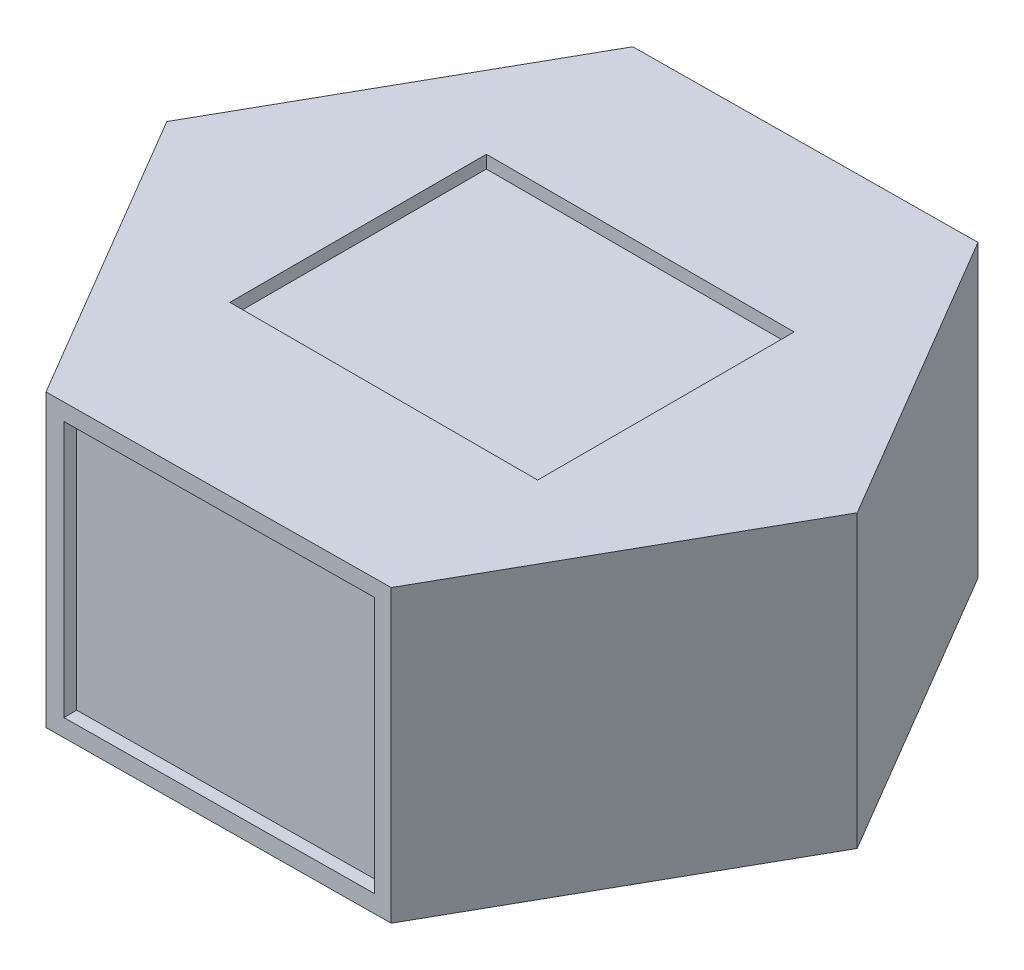
from build123d import *

# Parameters (mm, degrees)
BOSS_EXTRUDE1_DEPTH = 34
SKETCH2_W           = 36
SKETCH2_H           = 30
CUT_EXTRUDE1_DEPTH  = 1.5
SKETCH3_W           = 36
SKETCH3_H           = 30
CUT_EXTRUDE2_DEPTH  = 1.5
SKETCH4_W           = 36
SKETCH4_H           = 30
CUT_EXTRUDE3_DEPTH  = 1.5
CUT_EXTRUDE5_DEPTH  = 31.5
SKETCH6_W           = 37.25
SKETCH6_H           = 1.921966438
BOSS_EXTRUDE2_DEPTH = 5
SKETCH7_W           = 37.25
SKETCH7_H           = 2.5
BOSS_EXTRUDE3_DEPTH = 5


with BuildPart() as part:
    # Sketch1 → Boss-Extrude1 (new body)
    with BuildSketch(Plane(origin=(0, 0, 0), x_dir=(1, 0, 0), z_dir=(0, 1, 0))):
        Polygon((20.323082913, -34.452464366), (39.998250821, 0.374073902), (19.675167908, 34.826538269), (-20.323082913, 34.452464366), (-39.998250821, -0.374073902), (-19.675167908, -34.826538269), align=None)
    extrude(amount=BOSS_EXTRUDE1_DEPTH)

    # Sketch2 → Cut-Extrude1 (cut)
    with BuildSketch(Plane(origin=(0.323957502, 0, 34.639501318), x_dir=(0.9999562705174567, 0, -0.00935184756179416), z_dir=(0.009351847561794161, 0, 0.9999562705174567))):
        with Locations((0.07819078, 17.042979031)):
            Rectangle(SKETCH2_W, SKETCH2_H)
    extrude(amount=-CUT_EXTRUDE1_DEPTH, mode=Mode.SUBTRACT)

    # Sketch3 → Cut-Extrude2 (cut)
    with BuildSketch(Plane(origin=(-0.323957502, 0, -34.639501318), x_dir=(-0.9999562705174567, 0, 0.009351847561793986), z_dir=(-0.009351847561793988, 0, -0.9999562705174567))):
        with Locations((-0.090906466, 17.061793862)):
            Rectangle(SKETCH3_W, SKETCH3_H)
    extrude(amount=-CUT_EXTRUDE2_DEPTH, mode=Mode.SUBTRACT)

    # Sketch4 → Cut-Extrude3 (cut)
    with BuildSketch(Plane(origin=(0, 34, 0), x_dir=(1, 0, 0), z_dir=(0, 1, 0))):
        Rectangle(SKETCH4_W, SKETCH4_H)
    extrude(amount=-CUT_EXTRUDE3_DEPTH, mode=Mode.SUBTRACT)

    # Sketch5 → Cut-Extrude5 (cut)
    with BuildSketch(Plane.XZ):
        Polygon((37.249997801, -0.012800837), (18.63608475, 32.253043968), (-18.61391305, 32.265844805), (-37.249997801, 0.012800837), (-18.63608475, -32.253043968), (18.61391305, -32.265844805), align=None)
    extrude(amount=-CUT_EXTRUDE5_DEPTH, mode=Mode.SUBTRACT)

    # Sketch6 → Boss-Extrude2 (add)
    with BuildSketch(Plane(origin=(27.943041275, 0, 16.120121566), x_dir=(-0.4997023637702259, 0, 0.8661971759607906), z_dir=(-0.8661971759607907, 0, -0.499702363770226))):
        with Locations((-0.009802695, 3.460983219)):
            Rectangle(SKETCH6_W, SKETCH6_H)
    extrude(amount=BOSS_EXTRUDE2_DEPTH)

    # Sketch7 → Boss-Extrude3 (add)
    with BuildSketch(Plane(origin=(-27.943041275, 0, -16.120121566), x_dir=(0.49970236377022564, 0, -0.8661971759607908), z_dir=(0.8661971759607908, 0, 0.49970236377022564))):
        with Locations((-0.003212365, 3.584418616)):
            Rectangle(SKETCH7_W, SKETCH7_H)
    extrude(amount=BOSS_EXTRUDE3_DEPTH)


solid = part.part
